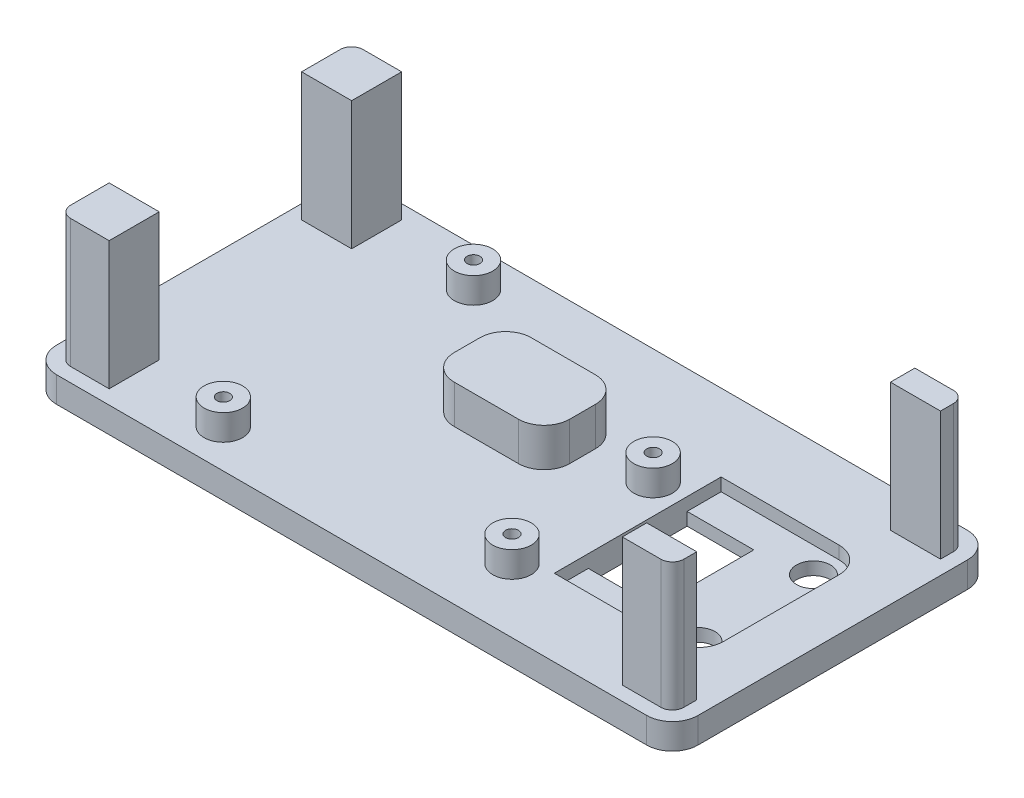
from build123d import *

# Parameters (mm, degrees)
SKETCH1_W            = 127
SKETCH1_H            = 63.5
BOSS_EXTRUDE1_DEPTH  = 5.08
SKETCH2_W            = 9.906
SKETCH2_H            = 9.906
SKETCH2_H_2          = 4.826
BOSS_EXTRUDE3_DEPTH  = 25.4
FILLET3_R            = 2.286
FILLET4_R            = 5.08
CUT_EXTRUDE8_REACH   = 146.244
SKETCH13_R           = 3.556
SKETCH13_W           = 13.208
SKETCH13_H           = 19.558
SKETCH14_W           = 13.208
SKETCH14_H           = 29.718
CUT_EXTRUDE9_DEPTH   = 2.54
SKETCH19_R           = 5.08
CUT_EXTRUDE12_DEPTH  = 2.54
SKETCH4_R            = 3.81
SKETCH4_R_2          = 1.27
BOSS_EXTRUDE13_DEPTH = 5.08
SKETCH7_W            = 22.86
SKETCH7_H            = 15.24
BOSS_EXTRUDE14_DEPTH = 7.62
FILLET5_R            = 5.08
CUT_EXTRUDE13_DEPTH  = 2.54
SKETCH22_R           = 4.329078616
SKETCH22_R_2         = 3.3655
SKETCH22_R_3         = 4.536345421
BOSS_EXTRUDE15_DEPTH = 2.54


with BuildPart() as part:
    # Sketch1 → Boss-Extrude1 (new body)
    with BuildSketch(Plane(origin=(0, 0, 0), x_dir=(1, 0, 0), z_dir=(0, 1, 0))):
        with Locations((63.5, 31.75)):
            Rectangle(SKETCH1_W, SKETCH1_H)
    extrude(amount=BOSS_EXTRUDE1_DEPTH)

    # Sketch2 → Boss-Extrude3 (add)
    with BuildSketch(Plane(origin=(0, 5.08, 0), x_dir=(1, 0, 0), z_dir=(0, 1, 0))):
        with Locations((7.747, 7.747)):
            Rectangle(SKETCH2_W, SKETCH2_H)
        with Locations((7.747, 55.753)):
            Rectangle(SKETCH2_W, SKETCH2_H)
        with Locations((119.253, 5.207)):
            Rectangle(SKETCH2_W, SKETCH2_H_2)
        with Locations((119.253, 58.293)):
            Rectangle(SKETCH2_W, SKETCH2_H_2)
    extrude(amount=BOSS_EXTRUDE3_DEPTH)

    # Fillet3
    fillet3_edges = [part.edges().sort_by_distance(p)[0] for p in [
        (2.794, 17.78, -60.706),
        (2.794, 17.78, -2.794),
        (124.206, 17.78, -60.706),
        (124.206, 17.78, -2.794),
    ]]
    fillet(fillet3_edges, radius=FILLET3_R)

    # Fillet4
    fillet4_edges = [part.edges().sort_by_distance(p)[0] for p in [
        (0, 2.54, -63.5),
        (127, 2.54, -63.5),
        (127, 2.54, 0),
        (0, 2.54, 0),
    ]]
    fillet(fillet4_edges, radius=FILLET4_R)

    # Sketch13 → Cut-Extrude8 (cut, up to next)
    with BuildSketch(Plane(origin=(0, 5.08, 0), x_dir=(1, 0, 0), z_dir=(0, 1, 0)), mode=Mode.PRIVATE) as cut_extrude8_sk1:
        with Locations(Location((111.76, 43.18, 0), (0, 0, 270))):
            Circle(SKETCH13_R)
    cut_extrude8_tool1 = extrude(cut_extrude8_sk1.sketch, amount=-CUT_EXTRUDE8_REACH, mode=Mode.PRIVATE) & part.part
    # Sketch13 → Cut-Extrude8 (cut, up to next)
    with BuildSketch(Plane(origin=(0, 5.08, 0), x_dir=(1, 0, 0), z_dir=(0, 1, 0)), mode=Mode.PRIVATE) as cut_extrude8_sk2:
        with Locations(Location((111.76, 20.32, 0), (0, 0, 270))):
            Circle(SKETCH13_R)
    cut_extrude8_tool2 = extrude(cut_extrude8_sk2.sketch, amount=-CUT_EXTRUDE8_REACH, mode=Mode.PRIVATE) & part.part
    # Sketch13 → Cut-Extrude8 (cut, up to next)
    with BuildSketch(Plane(origin=(0, 5.08, 0), x_dir=(1, 0, 0), z_dir=(0, 1, 0)), mode=Mode.PRIVATE) as cut_extrude8_sk3:
        with Locations((94.996, 31.75)):
            Rectangle(SKETCH13_W, SKETCH13_H)
    cut_extrude8_tool3 = extrude(cut_extrude8_sk3.sketch, amount=-CUT_EXTRUDE8_REACH, mode=Mode.PRIVATE) & part.part
    add(cut_extrude8_tool1.solids().sort_by_distance((111.76, 5.08, -43.18))[0], mode=Mode.SUBTRACT)
    add(cut_extrude8_tool2.solids().sort_by_distance((111.76, 5.08, -20.32))[0], mode=Mode.SUBTRACT)
    add(cut_extrude8_tool3.solids().sort_by_distance((94.996, 5.08, -31.75))[0], mode=Mode.SUBTRACT)

    # Sketch14 → Cut-Extrude9 (cut)
    with BuildSketch(Plane(origin=(0, 5.08, 0), x_dir=(1, 0, 0), z_dir=(0, 1, 0))):
        with Locations((94.996, 31.75)):
            Rectangle(SKETCH14_W, SKETCH14_H)
    extrude(amount=-CUT_EXTRUDE9_DEPTH, mode=Mode.SUBTRACT)

    # Sketch19 → Cut-Extrude12 (cut)
    with BuildSketch(Plane(origin=(0, 5.08, 0), x_dir=(1, 0, 0), z_dir=(0, 1, 0))):
        with Locations(Location((111.76, 43.18, 0), (0, 0, 270))):
            Circle(SKETCH19_R)
        with Locations(Location((111.76, 20.32, 0), (0, 0, 270))):
            Circle(SKETCH19_R)
    extrude(amount=-CUT_EXTRUDE12_DEPTH, mode=Mode.SUBTRACT)

    # Sketch4 → Boss-Extrude13 (add)
    # profile 1 of 4: a face of its own
    with BuildSketch(Plane(origin=(0, 5.08, 0), x_dir=(1, 0, 0), z_dir=(0, 1, 0))):
        with Locations(Location((31.75, 55.88, 0), (0, 0, 90))):
            Circle(SKETCH4_R)
        with Locations(Location((31.75, 55.88, 0), (0, 0, 270))):
            Circle(SKETCH4_R_2, mode=Mode.SUBTRACT)
    # profile 2 of 4: a face of its own
    with BuildSketch(Plane(origin=(0, 5.08, 0), x_dir=(1, 0, 0), z_dir=(0, 1, 0))):
        with Locations(Location((30.48, 7.62, 0), (0, 0, 90))):
            Circle(SKETCH4_R)
        with Locations(Location((30.48, 7.62, 0), (0, 0, 270))):
            Circle(SKETCH4_R_2, mode=Mode.SUBTRACT)
    # profile 3 of 4: a face of its own
    with BuildSketch(Plane(origin=(0, 5.08, 0), x_dir=(1, 0, 0), z_dir=(0, 1, 0))):
        with Locations(Location((82.55, 40.64, 0), (0, 0, 90))):
            Circle(SKETCH4_R)
        with Locations(Location((82.55, 40.64, 0), (0, 0, 270))):
            Circle(SKETCH4_R_2, mode=Mode.SUBTRACT)
    # profile 4 of 4: a face of its own
    with BuildSketch(Plane(origin=(0, 5.08, 0), x_dir=(1, 0, 0), z_dir=(0, 1, 0))):
        with Locations(Location((82.55, 12.7, 0), (0, 0, 90))):
            Circle(SKETCH4_R)
        with Locations(Location((82.55, 12.7, 0), (0, 0, 270))):
            Circle(SKETCH4_R_2, mode=Mode.SUBTRACT)
    extrude(amount=BOSS_EXTRUDE13_DEPTH)

    # Sketch7 → Boss-Extrude14 (add)
    with BuildSketch(Plane(origin=(0, 5.08, 0), x_dir=(1, 0, 0), z_dir=(0, 1, 0))):
        with Locations((59.69, 38.1)):
            Rectangle(SKETCH7_W, SKETCH7_H)
    extrude(amount=BOSS_EXTRUDE14_DEPTH)

    # Fillet5
    fillet5_edges = [part.edges().sort_by_distance(p)[0] for p in [
        (48.26, 8.89, -45.72),
        (48.26, 8.89, -30.48),
        (71.12, 8.89, -30.48),
        (71.12, 8.89, -45.72),
    ]]
    fillet(fillet5_edges, radius=FILLET5_R)

    # Sketch21 → Cut-Extrude13 (cut)
    with BuildSketch(Plane(origin=(0, 5.08, 0), x_dir=(1, 0, 0), z_dir=(0, 1, 0))):
        with BuildLine():
            Line((111.76, 48.26), (88.392, 48.26))
            Line((88.392, 48.26), (88.392, 15.24))
            Line((88.392, 15.24), (111.76, 15.24))
            ThreePointArc((111.76, 15.24), (115.352102448, 16.727897552), (116.84, 20.32))
            Line((116.84, 20.32), (116.84, 43.18))
            ThreePointArc((116.84, 43.18), (115.352102448, 46.772102448), (111.76, 48.26))
        make_face()
    extrude(amount=-CUT_EXTRUDE13_DEPTH, mode=Mode.SUBTRACT)

    # Sketch22 → Boss-Extrude15 (add)
    # profile 1 of 2: a face of its own
    with BuildSketch(Plane(origin=(0, 2.54, 0), x_dir=(1, 0, 0), z_dir=(0, 1, 0))):
        with Locations((111.76, 43.18)):
            Circle(SKETCH22_R)
        with Locations(Location((111.76, 43.18, 0), (0, 0, 270))):
            Circle(SKETCH22_R_2, mode=Mode.SUBTRACT)
    # profile 2 of 2: a face of its own
    with BuildSketch(Plane(origin=(0, 2.54, 0), x_dir=(1, 0, 0), z_dir=(0, 1, 0))):
        with Locations((111.76, 20.32)):
            Circle(SKETCH22_R_3)
        with Locations(Location((111.76, 20.32, 0), (0, 0, 270))):
            Circle(SKETCH22_R_2, mode=Mode.SUBTRACT)
    extrude(amount=-BOSS_EXTRUDE15_DEPTH)


solid = part.part
